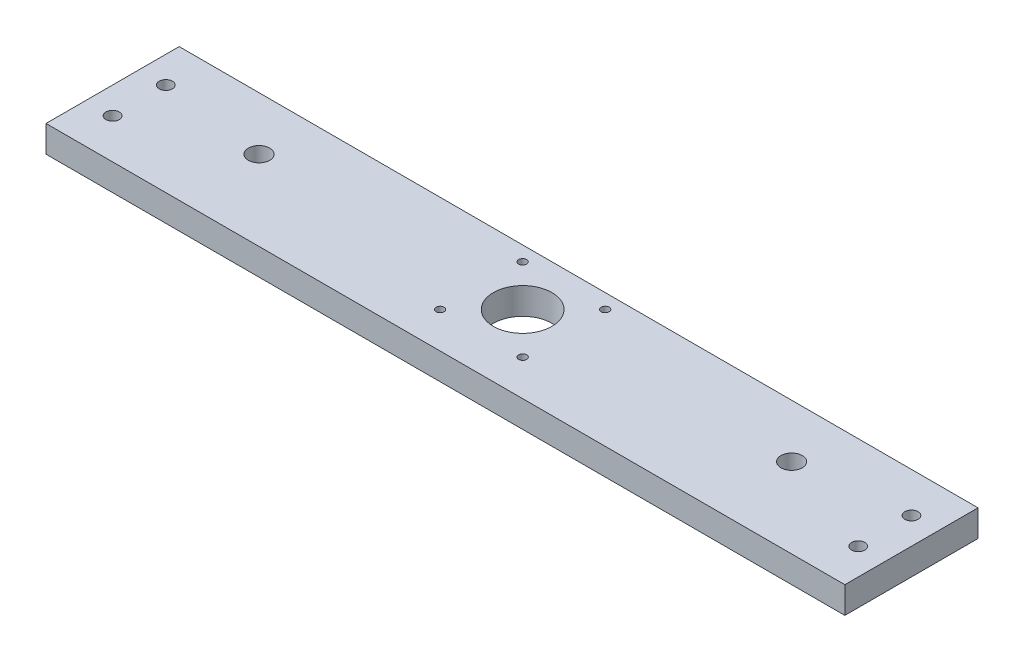
from build123d import *

# Parameters (mm, degrees)
SKETCH1_W           = 300
SKETCH1_H           = 50
SKETCH1_R           = 4
MAIN_DEPTH          = 10
SKETCH4_R           = 2.5
MOUNT_DEPTH         = 154.297097168
SKETCH2_R           = 11
SKETCH2_R_2         = 1.5
STEPPER_MOUNT_DEPTH = 154.297097168


with BuildPart() as part:
    # Sketch1 → main (new body)
    with BuildSketch(Plane(origin=(0, 0, 0), x_dir=(1, 0, 0), z_dir=(0, 1, 0))):
        with Locations((0, -5)):
            Rectangle(SKETCH1_W, SKETCH1_H)
        with Locations(Location((-100, 0, 0), (0, 0, 270))):
            Circle(SKETCH1_R, mode=Mode.SUBTRACT)
        with Locations(Location((100, 0, 0), (0, 0, 90))):
            Circle(SKETCH1_R, mode=Mode.SUBTRACT)
    extrude(amount=MAIN_DEPTH)

    # Sketch4 → mount (cut, through all)
    with BuildSketch(Plane(origin=(0, 10, 0), x_dir=(1, 0, 0), z_dir=(0, 1, 0))):
        with Locations(Location((-140, 5, 0), (0, 0, 270))):
            Circle(SKETCH4_R)
        with Locations(Location((-140, -15, 0), (0, 0, 90))):
            Circle(SKETCH4_R)
        with Locations(Location((140, -15, 0), (0, 0, 270))):
            Circle(SKETCH4_R)
        with Locations(Location((140, 5, 0), (0, 0, 90))):
            Circle(SKETCH4_R)
    extrude(amount=-MOUNT_DEPTH, mode=Mode.SUBTRACT)

    # Sketch2 → stepper_mount (cut, through all)
    with BuildSketch(Plane(origin=(0, 10, 0), x_dir=(1, 0, 0), z_dir=(0, 1, 0))):
        with Locations(Location((0, -1, 0), (0, 0, 270))):
            Circle(SKETCH2_R)
        with Locations(Location((15.5, -16.5, 0), (0, 0, 270))):
            Circle(SKETCH2_R_2)
        with Locations(Location((-15.5, -16.5, 0), (0, 0, 90))):
            Circle(SKETCH2_R_2)
        with Locations(Location((-15.5, 14.5, 0), (0, 0, 270))):
            Circle(SKETCH2_R_2)
        with Locations(Location((15.5, 14.5, 0), (0, 0, 90))):
            Circle(SKETCH2_R_2)
    extrude(amount=-STEPPER_MOUNT_DEPTH, mode=Mode.SUBTRACT)


solid = part.part
